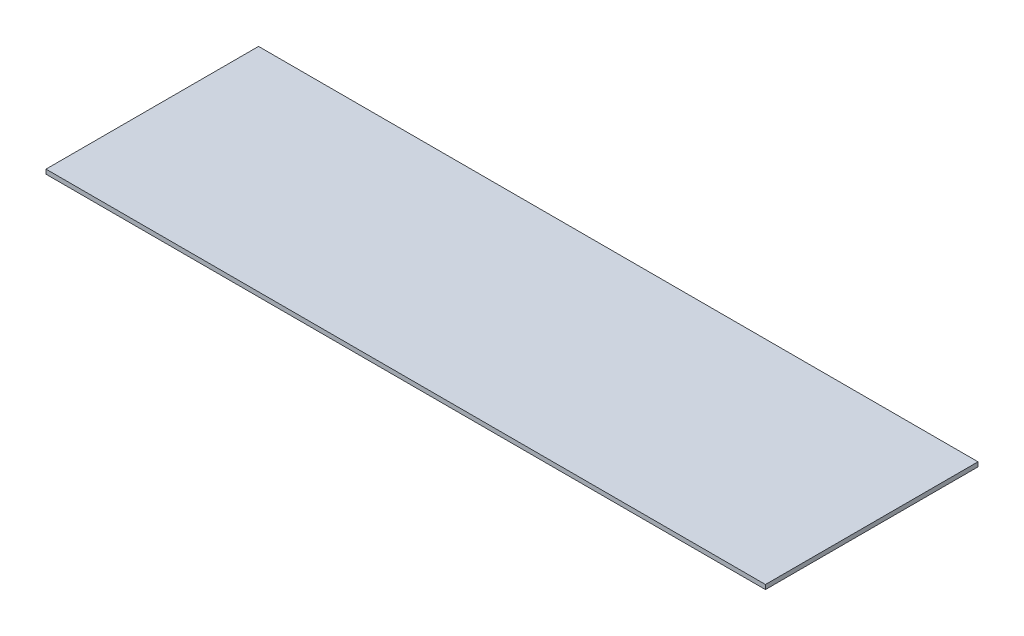
from build123d import *

# Parameters (mm, degrees)
SKETCH1_W           = 1031.748
SKETCH1_H           = 304.8
BOSS_EXTRUDE1_DEPTH = 6.35


with BuildPart() as part:
    # Sketch1 → Boss-Extrude1 (new body)
    with BuildSketch(Plane(origin=(0, 0, 0), x_dir=(1, 0, 0), z_dir=(0, 1, 0))):
        Rectangle(SKETCH1_W, SKETCH1_H)
    extrude(amount=BOSS_EXTRUDE1_DEPTH)


solid = part.part
